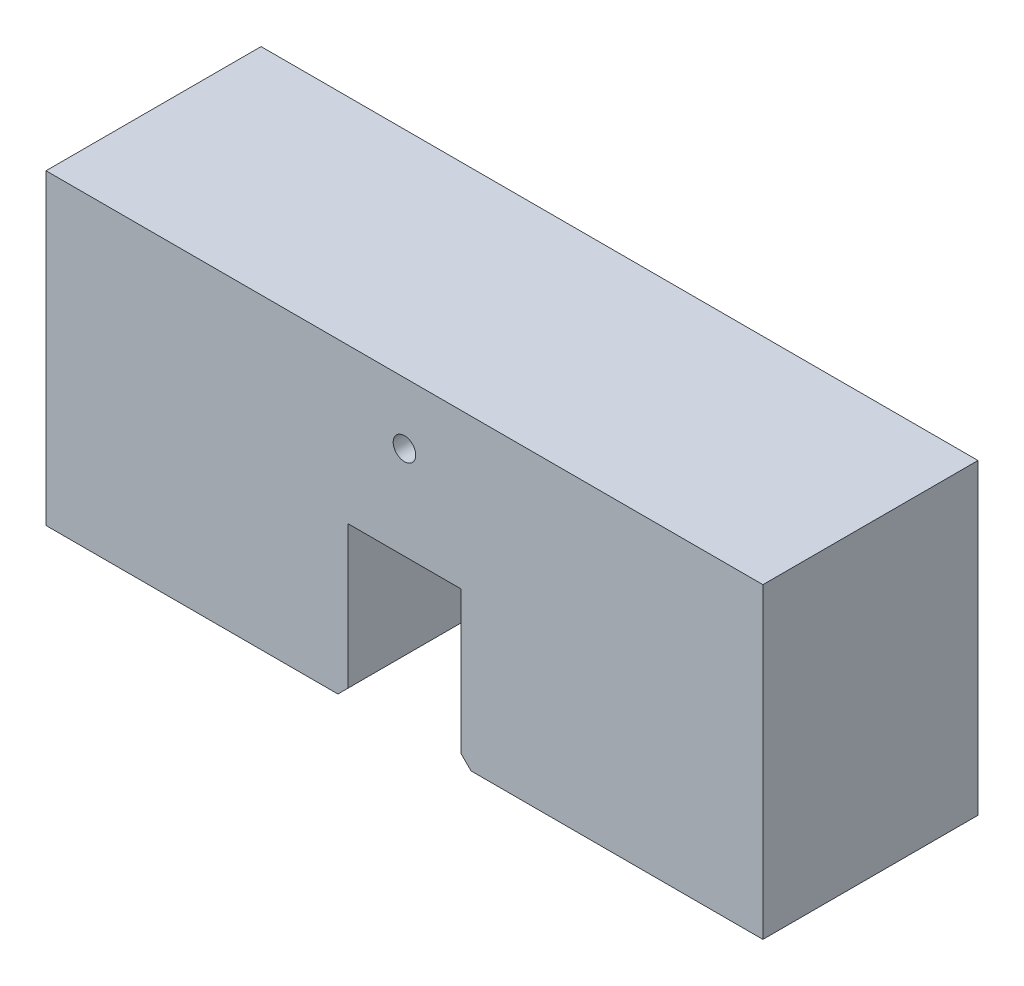
from build123d import *

# Parameters (mm, degrees)
BOSS_EXTRUDE1_DEPTH     = 105
CUT_EXTRUDE1_DEPTH      = 434.064318178
CUT_EXTRUDE1_DEPTH_BACK = 434.064318178
SKETCH2_R               = 11


with BuildPart() as part:
    # Sketch1 → Boss-Extrude1 (new, symmetric)
    with BuildSketch(Plane.XY):
        Polygon((350, 232.421392473), (-350, 232.421392473), (-350, -67.578607527), (-65, -67.578607527), (-55, -57.578607527), (-55, 81.421392473), (55, 81.421392473), (55, -57.578607527), (65, -67.578607527), (350, -67.578607527), align=None)
    extrude(amount=BOSS_EXTRUDE1_DEPTH, both=True)

    # Sketch2 → Cut-Extrude1 (cut, two sides: drawn at the far end of the back side and taken through both)
    with BuildSketch(Plane.XY.offset(-CUT_EXTRUDE1_DEPTH_BACK)):
        with Locations((0, 172.421392473)):
            Circle(SKETCH2_R)
    extrude(amount=CUT_EXTRUDE1_DEPTH + CUT_EXTRUDE1_DEPTH_BACK, mode=Mode.SUBTRACT)


solid = part.part
